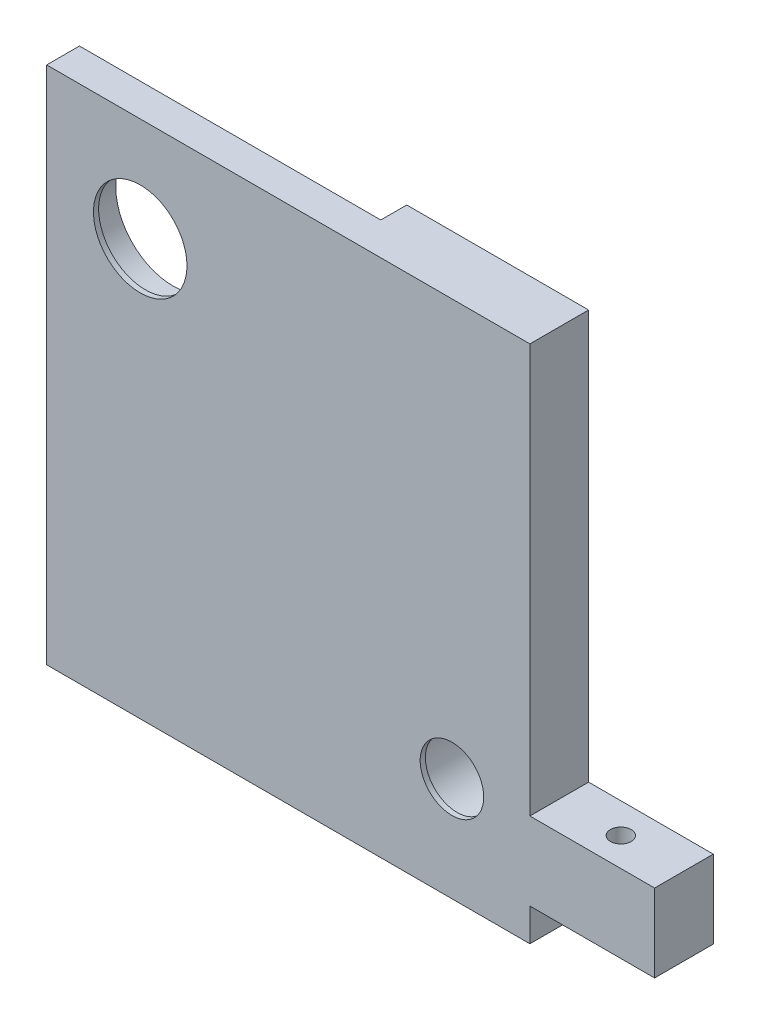
from build123d import *

# Parameters (mm, degrees)
SKETCH1_W           = 93
SKETCH1_H           = 100
BOSS_EXTRUDE2_DEPTH = 6.3
SKETCH3_W           = 35
SKETCH3_H           = 100
BOSS_EXTRUDE3_DEPTH = 5
SKETCH4_W           = 11.3
SKETCH4_H           = 15
BOSS_EXTRUDE4_DEPTH = 24
SKETCH5_R           = 2
CUT_EXTRUDE1_DEPTH  = 50
SKETCH6_R           = 8.115
CUT_EXTRUDE2_DEPTH  = 50
SKETCH7_R           = 11
CUT_EXTRUDE3_DEPTH  = 50
EXTRUDE_THIN1_START = -5.3
SKETCH7_2_R         = 11
SKETCH7_2_R_2       = 9
EXTRUDE_THIN1_DEPTH = 1
EXTRUDE_THIN2_START = -10.3
SKETCH6_2_R         = 8.115
SKETCH6_2_R_2       = 6.115
EXTRUDE_THIN2_DEPTH = 1


with BuildPart() as part:
    # Sketch1 → Boss-Extrude2 (new body)
    with BuildSketch(Plane.XY):
        with Locations((-29.68705036, 14.928057554)):
            Rectangle(SKETCH1_W, SKETCH1_H)
    extrude(amount=BOSS_EXTRUDE2_DEPTH)

    # Sketch3 → Boss-Extrude3 (add)
    with BuildSketch(Plane(origin=(0, 0, 0), x_dir=(-1, 0, 0), z_dir=(0, 0, -1))):
        with Locations((0.68705036, 14.928057554)):
            Rectangle(SKETCH3_W, SKETCH3_H)
    extrude(amount=BOSS_EXTRUDE3_DEPTH)

    # Sketch4 → Boss-Extrude4 (add)
    with BuildSketch(Plane(origin=(16.81294964, 0, 0), x_dir=(0, 0, -1), z_dir=(1, 0, 0))):
        with Locations((-0.65, -21.271942446)):
            Rectangle(SKETCH4_W, SKETCH4_H)
    extrude(amount=BOSS_EXTRUDE4_DEPTH)

    # Sketch5 → Cut-Extrude1 (cut)
    with BuildSketch(Plane(origin=(0, -13.771942446, 0), x_dir=(1, 0, 0), z_dir=(0, 1, 0))):
        with Locations(Location((28.81294964, -0.8, 0), (0, 0, 180))):
            Circle(SKETCH5_R)
    extrude(amount=-CUT_EXTRUDE1_DEPTH, mode=Mode.SUBTRACT)

    # Sketch6 → Cut-Extrude2 (cut)
    with BuildSketch(Plane(origin=(0, 0, -5), x_dir=(-1, 0, 0), z_dir=(0, 0, -1))):
        with Locations((-1.81294964, -15.071942446)):
            Circle(SKETCH6_R)
    extrude(amount=-CUT_EXTRUDE2_DEPTH, mode=Mode.SUBTRACT)

    # Sketch7 → Cut-Extrude3 (cut)
    with BuildSketch(Plane(origin=(0, 0, 0), x_dir=(-1, 0, 0), z_dir=(0, 0, -1))):
        with Locations((58.18705036, 44.928057554)):
            Circle(SKETCH7_R)
    extrude(amount=-CUT_EXTRUDE3_DEPTH, mode=Mode.SUBTRACT)

    # Sketch7<2> → Extrude-Thin1 (add)
    with BuildSketch(Plane(origin=(0, 0, 0), x_dir=(-1, 0, 0), z_dir=(0, 0, -1)).offset(EXTRUDE_THIN1_START)):
        with Locations((58.18705036, 44.928057554)):
            Circle(SKETCH7_2_R)
        with Locations((58.18705036, 44.928057554)):
            Circle(SKETCH7_2_R_2, mode=Mode.SUBTRACT)
    extrude(amount=-EXTRUDE_THIN1_DEPTH)

    # Sketch6<2> → Extrude-Thin2 (add)
    with BuildSketch(Plane(origin=(0, 0, -5), x_dir=(-1, 0, 0), z_dir=(0, 0, -1)).offset(EXTRUDE_THIN2_START)):
        with Locations((-1.81294964, -15.071942446)):
            Circle(SKETCH6_2_R)
        with Locations((-1.81294964, -15.071942446)):
            Circle(SKETCH6_2_R_2, mode=Mode.SUBTRACT)
    extrude(amount=-EXTRUDE_THIN2_DEPTH)


solid = part.part
